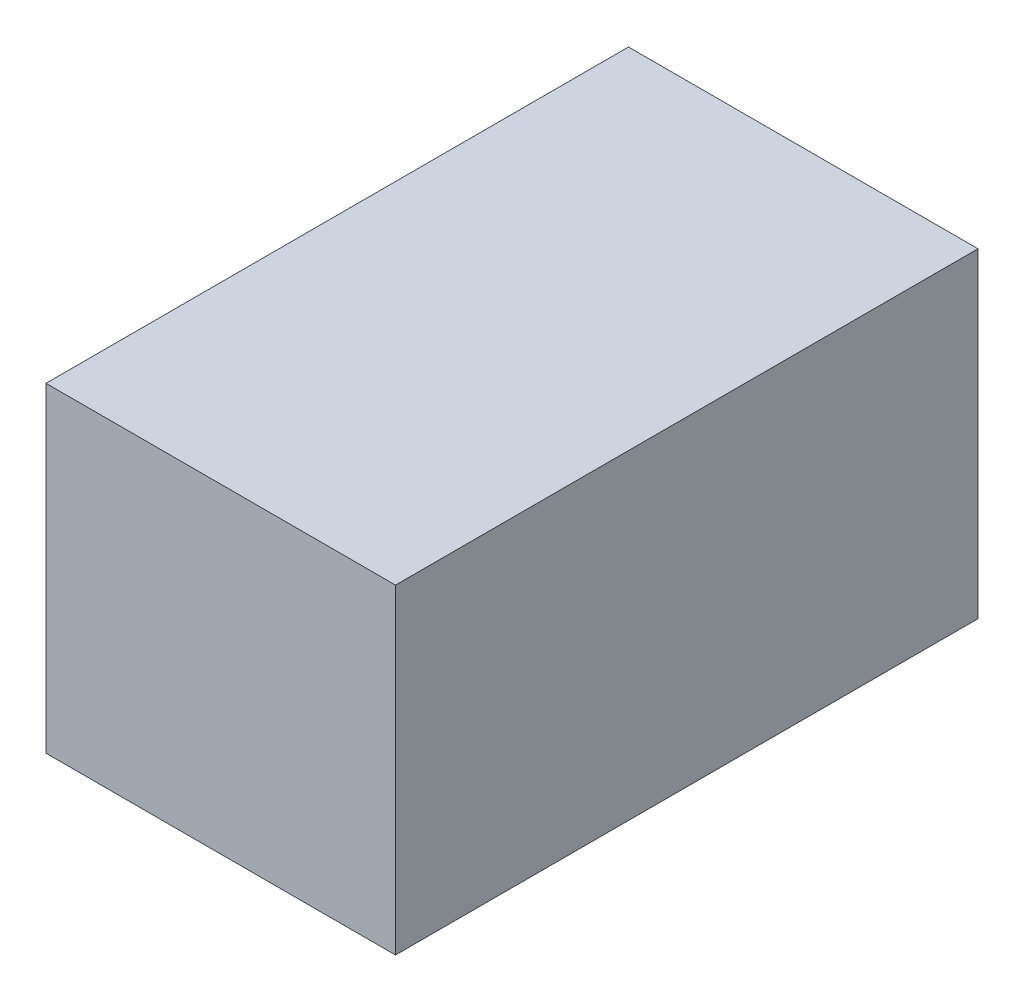
from build123d import *

# Parameters (mm, degrees)
SKETCH_1_W      = 12
SKETCH_1_H      = 11
EXTRUDE_1_DEPTH = 20
SKETCH_2_R      = 1.5
EXTRUDE_2_DEPTH = 1
SKETCH_3_R      = 0.75
EXTRUDE_3_DEPTH = 4.5


with BuildPart() as part:
    # ｽｹｯﾁ1 → ﾎﾞｽ - 押し出し1 (new body)
    with BuildSketch(Plane.XY):
        Rectangle(SKETCH_1_W, SKETCH_1_H)
    extrude(amount=EXTRUDE_1_DEPTH)

    # ｽｹｯﾁ2 → ﾎﾞｽ - 押し出し2 (add)
    with BuildSketch(Plane(origin=(0, 0, 0), x_dir=(-1, 0, 0), z_dir=(0, 0, -1))):
        Circle(SKETCH_2_R)
    extrude(amount=EXTRUDE_2_DEPTH)

    # ｽｹｯﾁ3 → ﾎﾞｽ - 押し出し3 (add)
    with BuildSketch(Plane(origin=(0, 0, 0), x_dir=(-1, 0, 0), z_dir=(0, 0, -1))):
        Circle(SKETCH_3_R)
    extrude(amount=EXTRUDE_3_DEPTH)


solid = part.part
